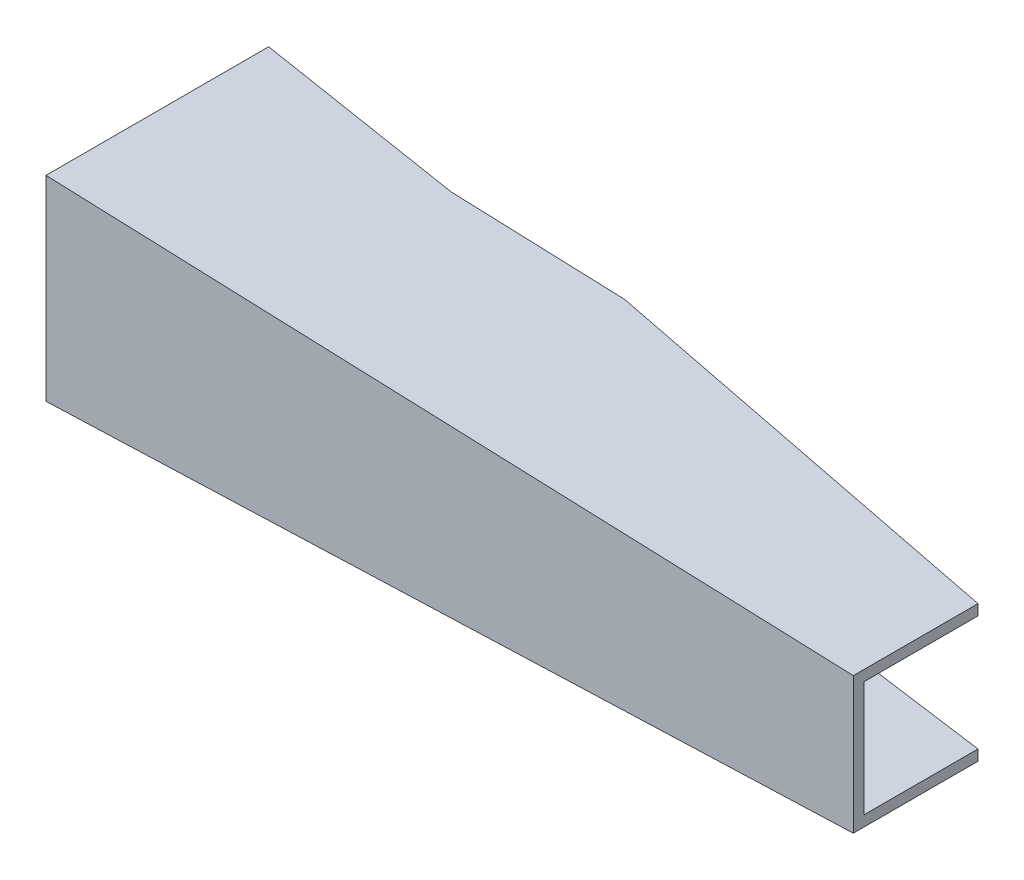
from build123d import *

# Parameters (mm, degrees)
BOSS_EXTRUDE1_DEPTH     = 105
CUT_EXTRUDE1_DEPTH      = 105.1
CUT_EXTRUDE1_DEPTH_BACK = 105.1


with BuildPart() as part:
    # Sketch1 → Boss-Extrude1 (new body)
    with BuildSketch(Plane.XY):
        Polygon((0, 39.555), (0, -39.555), (326.3, -27.585), (326.3, 27.585), align=None)
    extrude(amount=BOSS_EXTRUDE1_DEPTH)

    # Sketch3 → Cut-Extrude1 (cut, two sides: drawn at the far end of the back side and taken through both)
    with BuildSketch(Plane(origin=(0, 0, 0), x_dir=(1, 0, 0), z_dir=(0, 1, 0)).offset(-CUT_EXTRUDE1_DEPTH_BACK)):
        Polygon((0, -15), (84.7, -25.82), (154.7, -25.82), (326.3, -54.6), (326.3, 36.079011671), (0, 41.113860107), align=None)
    extrude(amount=CUT_EXTRUDE1_DEPTH + CUT_EXTRUDE1_DEPTH_BACK, mode=Mode.SUBTRACT)

    # Sketch4 → Cut-Loft1 section 0
    with BuildSketch(Plane(origin=(326.3, 0, 0), x_dir=(0, 0, -1), z_dir=(1, 0, 0))):
        with BuildLine():
            Line((-100.7, 23.285), (-22.554524003, 23.285))
            Line((-22.554524003, 23.285), (-22.554524003, -23.285))
            Line((-22.554524003, -23.285), (-100.7, -23.285))
            Line((-100.7, -23.285), (-100.7, 23.285))
        make_face()
    # Sketch5 → Cut-Loft1 section 1
    with BuildSketch(Plane.ZY):
        with BuildLine():
            Line((-10.956527507, 35.255), (100.7, 35.255))
            Line((100.7, 35.255), (100.7, -35.255))
            Line((100.7, -35.255), (-10.956527507, -35.255))
            Line((-10.956527507, -35.255), (-10.956527507, 35.255))
        make_face()
    loft(mode=Mode.SUBTRACT)


solid = part.part
